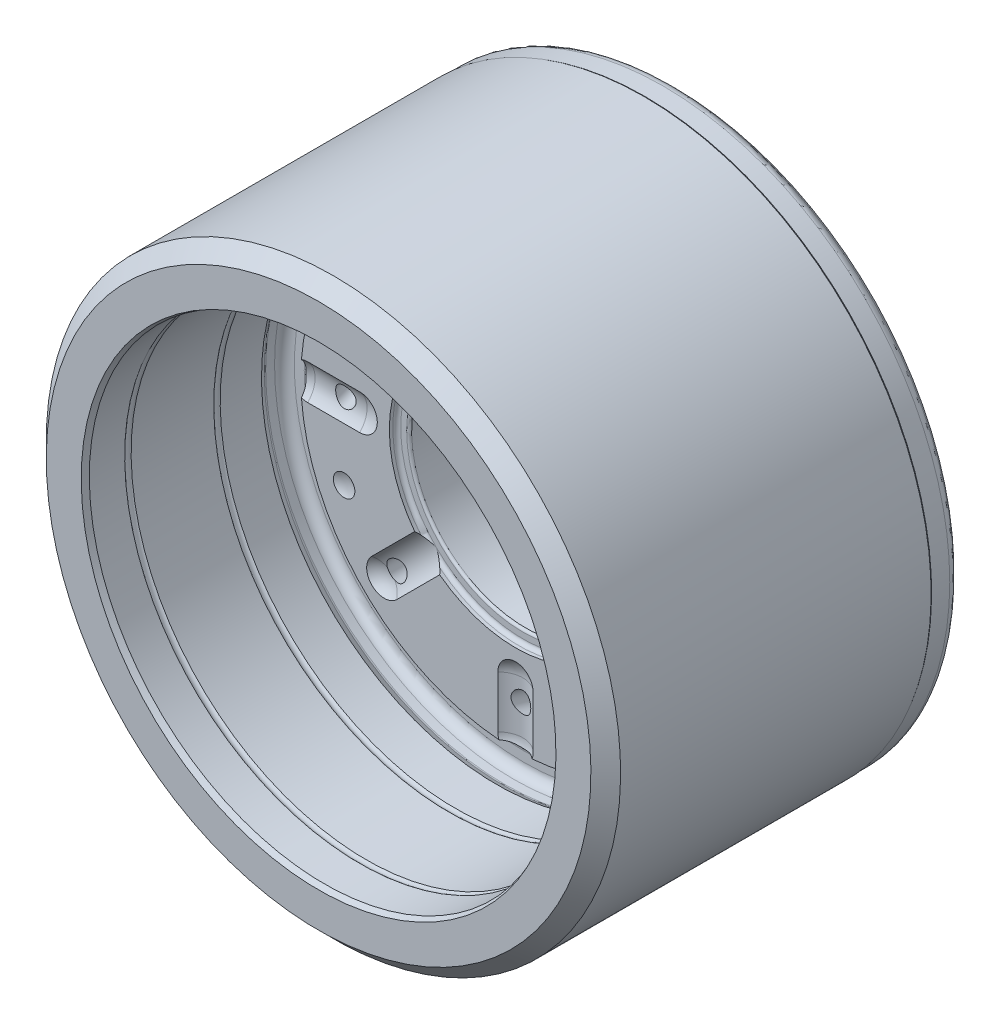
from build123d import *

# Parameters (mm, degrees)
FILLET1_R          = 2
CIRPATTERN1_COUNT  = 4
CIRPATTERN3_COUNT  = 4
CIRPATTERN2_COUNT  = 8
CIRPATTERN4_COUNT  = 4
CUT_EXTRUDE1_DEPTH = 0.1


with BuildPart() as part:
    # Sketch1 → Revolve1 (revolve)
    with BuildSketch(Plane(origin=(0, 0, 0), x_dir=(0, 0, -1), z_dir=(1, 0, 0))):
        with BuildLine():
            Line((0, 47.976764281), (1.2, 47.54))
            Line((1.2, 47.54), (8.35, 47.54))
            ThreePointArc((8.35, 47.54), (9, 47.780065792), (9.65, 47.54))
            Line((9.65, 47.54), (26.35, 47.54))
            ThreePointArc((26.35, 47.54), (27, 47.780065792), (27.65, 47.54))
            Line((27.65, 47.54), (36, 47.54))
            Line((36, 47.54), (37.303923048, 48.292820323))
            ThreePointArc((37.303923048, 48.292820323), (37.496867812, 48.372740661), (37.703923048, 48.4))
            Line((37.703923048, 48.4), (39.5, 48.4))
            ThreePointArc((39.5, 48.4), (40.914213562, 47.814213562), (41.5, 46.4))
            Line((41.5, 46.4), (41.5, 44.4))
            ThreePointArc((41.5, 44.4), (41.207106781, 43.692893219), (40.5, 43.4))
            Line((40.5, 43.4), (39.8, 43.4))
            Line((39.8, 43.4), (39.8, 25.5))
            Line((39.8, 25.5), (40.5, 25.5))
            ThreePointArc((40.5, 25.5), (41.065685425, 25.265685425), (41.3, 24.7))
            Line((41.3, 24.7), (41.3, 23.5))
            ThreePointArc((41.3, 23.5), (41.446446609, 23.146446609), (41.8, 23))
            Line((41.8, 23), (68, 23))
            ThreePointArc((68, 23), (68.353553391, 23.146446609), (68.5, 23.5))
            Line((68.5, 23.5), (68.5, 25.7))
            ThreePointArc((68.5, 25.7), (68.734314575, 26.265685425), (69.3, 26.5))
            Line((69.3, 26.5), (71.5, 26.5))
            ThreePointArc((71.5, 26.5), (71.853553391, 26.646446609), (72, 27))
            Line((72, 27), (72, 37.5))
            ThreePointArc((72, 37.5), (71.853553391, 37.853553391), (71.5, 38))
            Line((71.5, 38), (69, 38))
            ThreePointArc((69, 38), (67.585786438, 38.585786438), (67, 40))
            Line((67, 40), (67, 43.779733752))
            ThreePointArc((67, 43.779733752), (67.361695911, 44.926886625), (68.315959713, 45.659118994))
            Line((68.315959713, 45.659118994), (71.671010072, 46.880257459))
            ThreePointArc((71.671010072, 46.880257459), (71.909576022, 47.063315551), (72, 47.350103769))
            Line((72, 47.350103769), (72, 56.4))
            Line((72, 56.4), (70.5, 57.9))
            Line((70.5, 57.9), (66, 57.9))
            Line((66, 57.9), (65.757512887, 58.04))
            Line((65.757512887, 58.04), (3, 58.04))
            Line((3, 58.04), (0, 55.04))
            Line((0, 55.04), (0, 47.976764281))
        make_face()
    revolve(axis=Axis((0, 0, -19.396975733), (0, 0, 1)))

    # Fillet1
    fillet1_edges = [part.edges().sort_by_distance(p)[0] for p in [
        (0, -57.9, -70.5),
    ]]
    fillet(fillet1_edges, radius=FILLET1_R)

    # Sketch2 → Cut-Revolve1 (revolve, cut)
    with BuildSketch(Plane(origin=(0, 0, 0), x_dir=(0, 0, -1), z_dir=(1, 0, 0))):
        with BuildLine():
            Line((41.3, 42), (41.3, 31.5))
            ThreePointArc((41.3, 31.5), (39.835533906, 27.964466094), (36.3, 26.5))
            Line((36.3, 26.5), (36.3, 47))
            ThreePointArc((36.3, 47), (39.835533906, 45.535533906), (41.3, 42))
        make_face()
    cut_revolve1 = revolve(axis=Axis((0, 26.5, -36.3), (0, 1, 0)), mode=Mode.SUBTRACT)

    # CirPattern1: Cut-Revolve1 ×4 about axis
    cirpattern1_axis = Axis((0, 0, -19.396975733), (0, 0, -1))
    for i in range(1, CIRPATTERN1_COUNT):
        add(cut_revolve1.rotate(cirpattern1_axis, i * 360 / CIRPATTERN1_COUNT), mode=Mode.SUBTRACT)

    # Sketch3 → Cut-Revolve2 (revolve, cut)
    with BuildSketch(Plane(origin=(0, 0, 0), x_dir=(0, 0, 1), z_dir=(0.7071067811865464, 0.7071067811865488, 0))):
        with BuildLine():
            Line((-41.3, 37.5), (-41.3, 8.791773424))
            Line((-41.3, 8.791773424), (-36.3, 8.791773424))
            Line((-36.3, 8.791773424), (-36.3, 42.5))
            ThreePointArc((-36.3, 42.5), (-39.835533906, 41.035533906), (-41.3, 37.5))
        make_face()
    cut_revolve2 = revolve(axis=Axis((0.553509258, -0.553509258, -36.3), (0.7071067811865487, -0.7071067811865465, 0)), mode=Mode.SUBTRACT)

    # CirPattern3: Cut-Revolve2 ×4 about axis
    cirpattern3_axis = Axis((0, 0, -19.396975733), (0, 0, -1))
    for i in range(1, CIRPATTERN3_COUNT):
        add(cut_revolve2.rotate(cirpattern3_axis, i * 360 / CIRPATTERN3_COUNT), mode=Mode.SUBTRACT)

    # Sketch4 → 4MM HOLE Cut-Revolve3 (revolve, cut)
    with BuildSketch(Plane(origin=(0, 0, 0), x_dir=(0, 0, -1), z_dir=(1, 0, 0))):
        Polygon((71.48236191, 45.931851653), (34.777180511, 36.096727939), (34.134045021, 33.853847943), (72, 44), align=None)
    f_4mm_hole_cut_revolve3 = revolve(axis=Axis((0, 44, -72), (0, -0.2588190451025216, 0.9659258262890681)), mode=Mode.SUBTRACT)

    # CirPattern2: 4MM HOLE Cut-Revolve3 ×8 about axis
    cirpattern2_axis = Axis((0, 0, -19.396975733), (0, 0, -1))
    for i in range(1, CIRPATTERN2_COUNT):
        add(f_4mm_hole_cut_revolve3.rotate(cirpattern2_axis, i * 360 / CIRPATTERN2_COUNT), mode=Mode.SUBTRACT)

    # Sketch10 → WEAR INDICATOR Cut-Revolve3 (revolve, cut)
    with BuildSketch(Plane(origin=(0, 0, 0), x_dir=(0, 0, 1), z_dir=(-0.9238795325112865, -0.38268343236509056, 0))):
        with BuildLine():
            Line((-40.3, 37.5), (-18.472269002, 37.5))
            Line((-18.472269002, 37.5), (-18.472269002, 42.5))
            Line((-18.472269002, 42.5), (-35.3, 42.5))
            ThreePointArc((-35.3, 42.5), (-38.835533906, 41.035533906), (-40.3, 37.5))
        make_face()
    wear_indicator_cut_revolve3 = revolve(axis=Axis((-14.350628714, 34.645482469, -39.8), (0, 0, -1)), mode=Mode.SUBTRACT)

    # CirPattern4: WEAR INDICATOR Cut-Revolve3 ×4 about axis
    cirpattern4_axis = Axis((0, 0, -19.396975733), (0, 0, -1))
    for i in range(1, CIRPATTERN4_COUNT):
        add(wear_indicator_cut_revolve3.rotate(cirpattern4_axis, i * 360 / CIRPATTERN4_COUNT), mode=Mode.SUBTRACT)

    # Sketch8 → Cut-Extrude1 (cut)
    # profile 1 of 21: a face of its own
    with BuildSketch(Plane(origin=(0, 0, -72), x_dir=(-1, 0, 0), z_dir=(0, 0, -1))):
        Polygon((23.854300167, 19.760375543), (24.069444398, 19.48573612), (23.594684783, 18.205688043), (24.954660744, 18.35713035), (25.167401129, 18.085495735), (23.481103052, 17.89198612), (22.856103052, 16.197875543), (22.640958821, 16.472514966), (23.147569398, 17.854726504), (21.681824206, 17.695471697), (21.466079014, 17.97011112), (23.263554975, 18.16963035), align=None)
    # profile 2 of 21: a face of its own
    with BuildSketch(Plane(origin=(0, 0, -72), x_dir=(-1, 0, 0), z_dir=(0, 0, -1))):
        Polygon((21.978176565, 21.82611048), (22.216157334, 21.570701826), (21.851373681, 20.253995096), (23.193921758, 20.522023942), (23.429498681, 20.269620096), (21.765436181, 19.932480672), (21.287070796, 18.191495096), (21.049090027, 18.446903749), (21.436109258, 19.866975865), (19.989594834, 19.583322019), (19.751013104, 19.838730672), (21.524450604, 20.190894134), align=None)
    # profile 3 of 21: a face of its own
    with BuildSketch(Plane(origin=(0, 0, -72), x_dir=(-1, 0, 0), z_dir=(0, 0, -1))):
        Polygon((19.59696173, 21.709669369), (20.413067499, 20.943443407), (20.243596345, 20.762553984), (19.427490576, 21.528779946), align=None)
    # profile 4 of 21: a face of its own
    with BuildSketch(Plane(origin=(0, 0, -72), x_dir=(-1, 0, 0), z_dir=(0, 0, -1))):
        Polygon((19.337952914, 24.159704368), (19.788674068, 23.788911099), (17.905260607, 21.49624283), (17.677496183, 21.68374283), (19.376414453, 23.752252445), (19.016438491, 24.047925522), align=None)
    # profile 5 of 21: a face of its own
    with BuildSketch(Plane(origin=(0, 0, -72), x_dir=(-1, 0, 0), z_dir=(0, 0, -1))):
        Polygon((17.337174867, 25.6463853), (17.81493929, 25.303236262), (16.068545059, 22.872346839), (15.827559482, 23.045423762), (17.403280636, 25.238332416), (17.021069097, 25.512971839), align=None)
    # profile 6 of 21: a face of its own
    with BuildSketch(Plane(origin=(0, 0, -72), x_dir=(-1, 0, 0), z_dir=(0, 0, -1))):
        Polygon((15.128989206, 27.028431216), (15.639205552, 26.735161985), (14.146417091, 24.138407177), (13.888604591, 24.286844677), (15.235359398, 26.629392754), (14.827907475, 26.863166793), align=None)
    # profile 7 of 21: a face of its own
    with BuildSketch(Plane(origin=(0, 0, -72), x_dir=(-1, 0, 0), z_dir=(0, 0, -1))):
        Polygon((12.849647008, 28.179563056), (13.381497969, 27.929563056), (12.108060469, 25.222231326), (11.839430662, 25.348433249), (12.988469123, 27.790740941), (12.562988354, 27.990861133), align=None)
    # profile 8 of 21: a face of its own
    with BuildSketch(Plane(origin=(0, 0, -72), x_dir=(-1, 0, 0), z_dir=(0, 0, -1))):
        Polygon((10.480333402, 29.129734849), (11.028410325, 28.924806964), (9.985141094, 26.134542541), (9.708698786, 26.237907925), (10.649804555, 28.754734849), (10.211102632, 28.918797349), align=None)
    # profile 9 of 21: a face of its own
    with BuildSketch(Plane(origin=(0, 0, -72), x_dir=(-1, 0, 0), z_dir=(0, 0, -1))):
        Polygon((3.000616351, 30.829381525), (4.146650005, 27.730823833), (3.826337505, 27.75726614), (3.438116351, 28.777698833), (2.152058659, 28.883468063), (1.605183659, 27.939958448), (1.272250966, 27.967001717), (2.927299043, 30.83539114), align=None)
        Polygon((2.912275005, 30.199573833), (2.310111543, 29.160511333), (3.330544236, 29.076376717), align=None, mode=Mode.SUBTRACT)
    # profile 10 of 21: a face of its own
    with BuildSketch(Plane(origin=(0, 0, -72), x_dir=(-1, 0, 0), z_dir=(0, 0, -1))):
        Polygon((-1.261860941, 29.214776951), (-0.145875365, 29.23761349), (-0.141067672, 28.990618297), (-1.257053249, 28.967781759), align=None)
    # profile 11 of 21: a face of its own
    with BuildSketch(Plane(origin=(0, 0, -72), x_dir=(-1, 0, 0), z_dir=(0, 0, -1))):
        Polygon((-4.413552643, 30.635439153), (-3.832422836, 30.707554537), (-3.464033413, 27.75142473), (-3.757903605, 27.714766076), (-4.090235336, 30.381232422), (-4.554177643, 30.323540114), align=None)
    # profile 12 of 21: a face of its own
    with BuildSketch(Plane(origin=(0, 0, -72), x_dir=(-1, 0, 0), z_dir=(0, 0, -1))):
        Polygon((-7.378386469, 30.085449511), (-5.520814353, 30.473670665), (-6.459516276, 27.14374278), (-6.7263432, 27.217060088), (-5.916848007, 30.101675472), (-7.3200932, 29.808406242), align=None)
    # profile 13 of 21: a face of its own
    with BuildSketch(Plane(origin=(0, 0, -72), x_dir=(-1, 0, 0), z_dir=(0, 0, -1))):
        Polygon((-10.608094085, 29.090068096), (-10.054608508, 29.284178673), (-9.067829662, 26.466270019), (-9.347276777, 26.368313288), (-10.237300816, 28.910380596), (-10.679608508, 28.755332519), align=None)
    # profile 14 of 21: a face of its own
    with BuildSketch(Plane(origin=(0, 0, -72), x_dir=(-1, 0, 0), z_dir=(0, 0, -1))):
        Polygon((-12.96834317, 28.125658666), (-12.431083554, 28.364841358), (-11.213535478, 25.629865397), (-11.485170093, 25.509072127), (-12.583126824, 27.976019243), (-13.012814324, 27.784913474), align=None)
    # profile 15 of 21: a face of its own
    with BuildSketch(Plane(origin=(0, 0, -72), x_dir=(-1, 0, 0), z_dir=(0, 0, -1))):
        with BuildLine():
            Line((-13.738896429, 24.287135812), (-14.030963737, 24.307568505))
            Line((-14.030963737, 24.307568505), (-13.913776237, 25.770909851))
            add(Edge.make_bspline(
                [(-13.913776237, 25.770909851), (-13.93312239, 25.750980634), (-13.970773973, 25.712194291), (-14.030861273, 25.660174862), (-14.091743855, 25.614769307), (-14.134494441, 25.589658071), (-14.155362775, 25.577400235)],
                knots=[0, 0, 0, 0, 1.072129487, 2.086583847, 3.065982227, 4, 4, 4, 4], degree=3))
            add(Edge.make_bspline(
                [(-14.155362775, 25.577400235), (-14.181366961, 25.564055474), (-14.232546787, 25.537791143), (-14.312573695, 25.507864899), (-14.393132776, 25.485581362), (-14.475110138, 25.474102464), (-14.55781575, 25.469372301), (-14.641579279, 25.474619018), (-14.726191673, 25.487703831), (-14.810354131, 25.510216728), (-14.89269322, 25.539579428), (-14.970624749, 25.577519114), (-15.044298008, 25.620844074), (-15.112069921, 25.672897219), (-15.175270178, 25.731028265), (-15.233247559, 25.796593477), (-15.286413488, 25.868798979), (-15.317076966, 25.921057925), (-15.332646429, 25.947592543)],
                knots=[0, 0, 0, 0, 1.019339521, 2.006200876, 2.976276971, 3.93042557, 4.889505071, 5.862926222, 6.853742157, 7.872913828, 8.899111551, 9.899769985, 10.893762844, 11.87677803, 12.876190055, 13.886449974, 14.92683936, 16, 16, 16, 16], degree=3))
            add(Edge.make_bspline(
                [(-15.332646429, 25.947592543), (-15.351736849, 25.985200745), (-15.389262466, 26.05912636), (-15.426595354, 26.176324465), (-15.449880345, 26.294523567), (-15.454632806, 26.413898204), (-15.445019244, 26.532886602), (-15.417302689, 26.649154716), (-15.37482835, 26.762714384), (-15.316069796, 26.871029307), (-15.243768912, 26.97219502), (-15.159497589, 27.062914906), (-15.06490175, 27.143031089), (-14.993957331, 27.185320534), (-14.958247391, 27.206606966)],
                knots=[0, 0, 0, 0, 1.035927997, 2.036300839, 3.014288727, 3.990922671, 4.965229411, 5.941726614, 6.920979799, 7.939511894, 8.963677912, 9.971341679, 10.978872915, 12, 12, 12, 12], degree=3))
            add(Edge.make_bspline(
                [(-14.958247391, 27.206606966), (-14.921824164, 27.225045997), (-14.850030448, 27.261391117), (-14.735384096, 27.29801872), (-14.617993178, 27.319368277), (-14.498388385, 27.324311989), (-14.379266228, 27.315398065), (-14.262943239, 27.289061016), (-14.1511557, 27.246667709), (-14.045009027, 27.188700635), (-13.946701435, 27.11827096), (-13.857624489, 27.037336461), (-13.781301435, 26.944613441), (-13.739891873, 26.876221453), (-13.719064698, 26.841823312)],
                knots=[0, 0, 0, 0, 1.021108704, 2.012704402, 3.001707623, 4.001103368, 5.002700386, 5.984923454, 6.977280357, 7.987485027, 9.005186405, 9.999405796, 10.993789729, 12, 12, 12, 12], degree=3))
            add(Edge.make_bspline(
                [(-13.719064698, 26.841823312), (-13.704920051, 26.814018733), (-13.676107332, 26.75738066), (-13.641993394, 26.666178452), (-13.616045938, 26.568429975), (-13.599369774, 26.482649573), (-13.58997291, 26.409652539), (-13.584467711, 26.350331013), (-13.58173016, 26.286962631), (-13.580511748, 26.219631984), (-13.58123227, 26.148097249), (-13.583472333, 26.072538343), (-13.588501725, 25.993009593), (-13.592972205, 25.938771094), (-13.595266621, 25.910933889)],
                knots=[0, 0, 0, 0, 1.177522787, 2.398620042, 3.66865854, 4.993684901, 5.695620907, 6.447709179, 7.243002857, 8.09049103, 8.990835468, 9.944587925, 10.945086475, 12, 12, 12, 12], degree=3))
            Line((-13.595266621, 25.910933889), (-13.738896429, 24.287135812))
        make_face()
        with BuildLine():
            add(Edge.make_bspline(
                [(-14.221468544, 25.841222351), (-14.202799128, 25.852069887), (-14.16617153, 25.873351709), (-14.116093227, 25.911156314), (-14.070361198, 25.952330637), (-14.029762646, 25.997596724), (-13.994486467, 26.0471986), (-13.963857286, 26.100085221), (-13.937682683, 26.156891359), (-13.917698694, 26.217265332), (-13.902854096, 26.278980005), (-13.893303523, 26.340912964), (-13.891465026, 26.402121413), (-13.893685249, 26.462842245), (-13.904742521, 26.522454489), (-13.919891766, 26.581655019), (-13.942596799, 26.639887092), (-13.961722929, 26.677317936), (-13.971468544, 26.69639062)],
                knots=[0, 0, 0, 0, 1.044606474, 2.049417247, 3.031310928, 4.020411352, 4.98666017, 5.973141717, 6.975703122, 8.009310334, 9.04673295, 10.046663694, 11.03671472, 12.007819091, 12.982066594, 13.965444113, 14.963303046, 16, 16, 16, 16], degree=3))
            add(Edge.make_bspline(
                [(-13.971468544, 26.69639062), (-13.982127124, 26.714846298), (-14.003170678, 26.751283896), (-14.040578706, 26.801357577), (-14.082601868, 26.845904502), (-14.127413447, 26.886519455), (-14.176879689, 26.921510159), (-14.229573564, 26.952338769), (-14.286697856, 26.977625854), (-14.346713557, 26.997687503), (-14.408401422, 27.012766335), (-14.470161239, 27.021988625), (-14.531600713, 27.024292901), (-14.592180765, 27.020708421), (-14.652291654, 27.011212127), (-14.71148804, 26.994445741), (-14.770467628, 26.972633129), (-14.808187513, 26.953200285), (-14.827237775, 26.943385812)],
                knots=[0, 0, 0, 0, 1.032047237, 2.03760182, 3.019646928, 3.995774453, 4.962738536, 5.949950324, 6.949255225, 7.983627563, 9.012383358, 10.022658113, 11.003743442, 11.98578855, 12.959161583, 13.945800631, 14.962535633, 16, 16, 16, 16], degree=3))
            add(Edge.make_bspline(
                [(-14.827237775, 26.943385812), (-14.845706723, 26.932740683), (-14.88217052, 26.911723685), (-14.932170696, 26.874033244), (-14.977419419, 26.832699056), (-15.017238745, 26.78700832), (-15.053050285, 26.738203806), (-15.083953108, 26.685133585), (-15.108772631, 26.627574864), (-15.129936363, 26.567677129), (-15.144759203, 26.505832791), (-15.154051641, 26.44409607), (-15.156332733, 26.382855541), (-15.152784025, 26.322457887), (-15.143031906, 26.262683296), (-15.127536969, 26.20356482), (-15.104927494, 26.145319215), (-15.085788184, 26.107890237), (-15.076035852, 26.088818505)],
                knots=[0, 0, 0, 0, 1.032821103, 2.039129686, 3.029037543, 3.999452854, 4.972829049, 5.960781083, 6.969711485, 8.007999216, 9.037526408, 10.048558702, 11.030379685, 12.003465044, 12.977567947, 13.962411326, 14.961757705, 16, 16, 16, 16], degree=3))
            add(Edge.make_bspline(
                [(-15.076035852, 26.088818505), (-15.065390948, 26.07034913), (-15.044374393, 26.033884491), (-15.006680706, 25.983890474), (-14.965358517, 25.938618992), (-14.919623893, 25.898882908), (-14.871064037, 25.862819026), (-14.817552617, 25.833186754), (-14.761006539, 25.806754564), (-14.700574707, 25.786950587), (-14.638943064, 25.771704307), (-14.576871988, 25.763550787), (-14.515740801, 25.760123625), (-14.4550352, 25.763728798), (-14.395402661, 25.774417319), (-14.336204692, 25.789667045), (-14.277971928, 25.812344959), (-14.24054118, 25.831474829), (-14.221468544, 25.841222351)],
                knots=[0, 0, 0, 0, 1.032992473, 2.039468027, 3.029540134, 4.00011646, 4.973654162, 5.956934718, 6.961157176, 7.996476879, 9.035618306, 10.035838455, 11.027957988, 12.001204806, 12.977066452, 13.96207324, 14.961585436, 16, 16, 16, 16], degree=3))
        make_face(mode=Mode.SUBTRACT)
    # profile 16 of 21: a face of its own
    with BuildSketch(Plane(origin=(0, 0, -72), x_dir=(-1, 0, 0), z_dir=(0, 0, -1))):
        Polygon((-18.821462091, 24.576299722), (-17.29742363, 25.679064145), (-16.799226514, 22.284833376), (-17.070260168, 22.24336703), (-17.505356322, 25.182068953), (-18.65679863, 24.349136261), align=None)
    # profile 17 of 21: a face of its own
    with BuildSketch(Plane(origin=(0, 0, -72), x_dir=(-1, 0, 0), z_dir=(0, 0, -1))):
        with BuildLine():
            add(Edge.make_bspline(
                [(-19.944812924, 21.714765492), (-19.975745441, 21.751192479), (-20.035782828, 21.821894166), (-20.118618648, 21.928758828), (-20.193968841, 22.031286282), (-20.260848803, 22.130145332), (-20.318438845, 22.225512189), (-20.369249743, 22.316120557), (-20.409754748, 22.404035566), (-20.443530472, 22.488158274), (-20.469297829, 22.569836146), (-20.489558786, 22.649450693), (-20.502970045, 22.72768144), (-20.512512316, 22.804058439), (-20.515544823, 22.879034025), (-20.512446725, 22.952361094), (-20.504092655, 23.02409725), (-20.490244563, 23.09403437), (-20.471085398, 23.161741396), (-20.44690635, 23.226729603), (-20.41857927, 23.289095623), (-20.385543159, 23.34866197), (-20.347535863, 23.405340608), (-20.304704799, 23.458987856), (-20.257047749, 23.509608096), (-20.222474899, 23.540914994), (-20.20502927, 23.556712608)],
                knots=[0, 0, 0, 0, 1.644029868, 3.190922287, 4.650811431, 6.021416974, 7.295645233, 8.483234603, 9.593293926, 10.623587759, 11.600101059, 12.537878117, 13.447786021, 14.329186333, 15.18452019, 16.026080918, 16.851915477, 17.666980841, 18.476431854, 19.27020876, 20.050526242, 20.831087192, 21.611008875, 22.395697237, 23.190460963, 24, 24, 24, 24], degree=3))
            add(Edge.make_bspline(
                [(-20.20502927, 23.556712608), (-20.186648297, 23.57205879), (-20.150217052, 23.602475053), (-20.091574486, 23.642132119), (-20.03070968, 23.67634943), (-19.968045871, 23.705874466), (-19.903500513, 23.730825447), (-19.836710533, 23.749994008), (-19.767736323, 23.763732811), (-19.696863922, 23.772816575), (-19.624325317, 23.776493622), (-19.550565285, 23.773999378), (-19.475827516, 23.765496563), (-19.399922071, 23.750932135), (-19.323001672, 23.730474854), (-19.245179454, 23.703765715), (-19.166349237, 23.671168611), (-19.086249164, 23.632543585), (-19.004548524, 23.587482843), (-18.922142462, 23.533422589), (-18.837997113, 23.471541539), (-18.752855125, 23.400966749), (-18.666102312, 23.322507553), (-18.577811944, 23.235976725), (-18.488360683, 23.14082972), (-18.429392075, 23.073715721), (-18.399139847, 23.039284723)],
                knots=[0, 0, 0, 0, 0.817209956, 1.619717106, 2.412988777, 3.19935934, 3.983137515, 4.773306705, 5.568787025, 6.382410885, 7.21107675, 8.046014192, 8.89957212, 9.776916611, 10.682806885, 11.615091664, 12.584284537, 13.593861856, 14.650204943, 15.767672928, 16.956528171, 18.215046031, 19.542020395, 20.949564044, 22.435057429, 24, 24, 24, 24], degree=3))
            add(Edge.make_bspline(
                [(-18.399139847, 23.039284723), (-18.369881681, 23.004402931), (-18.312734242, 22.936271351), (-18.232829714, 22.833878282), (-18.161351128, 22.73371187), (-18.096497998, 22.63725715), (-18.040520281, 22.542649891), (-17.992374437, 22.450778809), (-17.951638229, 22.361636292), (-17.919230175, 22.274726904), (-17.893126222, 22.190239467), (-17.873358657, 22.107686837), (-17.858636166, 22.02708039), (-17.85008959, 21.948139351), (-17.847841294, 21.870809656), (-17.850490285, 21.79523883), (-17.859770741, 21.721537424), (-17.874006115, 21.649954338), (-17.894096322, 21.580757688), (-17.918369023, 21.514071109), (-17.948409199, 21.450722126), (-17.981699171, 21.389548109), (-18.021139276, 21.33207642), (-18.064472542, 21.277055476), (-18.112598795, 21.225055863), (-18.148070352, 21.19345129), (-18.16596677, 21.177505877)],
                knots=[0, 0, 0, 0, 1.556205287, 3.039600934, 4.438183977, 5.761895265, 7.011408319, 8.193647714, 9.306086448, 10.35917686, 11.362025172, 12.326963321, 13.259128486, 14.16125834, 15.038165563, 15.90162898, 16.743313973, 17.574572791, 18.39381483, 19.204079234, 19.997502707, 20.788292034, 21.582158603, 22.376733614, 23.181015553, 24, 24, 24, 24], degree=3))
            add(Edge.make_bspline(
                [(-18.16596677, 21.177505877), (-18.184194687, 21.162622593), (-18.220288121, 21.133151926), (-18.277565439, 21.0938193), (-18.337178709, 21.060474705), (-18.398412342, 21.031042104), (-18.46177966, 21.007217849), (-18.527325481, 20.988493383), (-18.5945946, 20.974565613), (-18.663940219, 20.966265335), (-18.734678526, 20.963084148), (-18.806399643, 20.966381241), (-18.878959596, 20.974687717), (-18.952456266, 20.98933319), (-19.026998474, 21.009726212), (-19.102260063, 21.036620443), (-19.178689028, 21.068301969), (-19.256174078, 21.106614498), (-19.335461227, 21.151729558), (-19.416088515, 21.206371182), (-19.498827994, 21.269739008), (-19.58434757, 21.341201696), (-19.671237512, 21.42218058), (-19.760954471, 21.511245429), (-19.852957886, 21.609268276), (-19.913589965, 21.678905345), (-19.944812924, 21.714765492)],
                knots=[0, 0, 0, 0, 0.810632812, 1.605149, 2.390224817, 3.162081483, 3.944086726, 4.71963798, 5.508829557, 6.308456187, 7.123660273, 7.945760539, 8.779656246, 9.637878073, 10.525355896, 11.440036421, 12.389901381, 13.37461292, 14.416519684, 15.53068256, 16.727572739, 18.006365248, 19.369131277, 20.818699714, 22.361764809, 24, 24, 24, 24], degree=3))
        make_face()
        with BuildLine():
            add(Edge.make_bspline(
                [(-19.727264847, 21.893852031), (-19.7006236, 21.863022591), (-19.648956755, 21.803233353), (-19.570546251, 21.719283202), (-19.495724899, 21.642214079), (-19.423631508, 21.572980187), (-19.354535844, 21.511557678), (-19.28845333, 21.457598122), (-19.224607967, 21.411996222), (-19.163651431, 21.372812426), (-19.103767805, 21.340996765), (-19.045628723, 21.312665624), (-18.987051114, 21.290816816), (-18.929573731, 21.272566764), (-18.872546565, 21.25904422), (-18.815832843, 21.250884502), (-18.75958775, 21.246166227), (-18.686471479, 21.248374648), (-18.598968473, 21.258981929), (-18.5008633, 21.287891639), (-18.410614856, 21.329207205), (-18.359211435, 21.369163566), (-18.333635039, 21.389044338)],
                knots=[0, 0, 0, 0, 1.475909868, 2.862313715, 4.160626624, 5.366757585, 6.482248386, 7.509049202, 8.455550054, 9.323242429, 10.131745549, 10.910792781, 11.664169876, 12.394043606, 13.094613191, 13.784273586, 14.468298686, 15.136079208, 16.431326151, 17.648431549, 18.829948603, 20, 20, 20, 20], degree=3))
            add(Edge.make_bspline(
                [(-18.333635039, 21.389044338), (-18.30969484, 21.41167849), (-18.262155325, 21.456624505), (-18.206426105, 21.538962569), (-18.163639022, 21.630429189), (-18.1391693, 21.713681743), (-18.127350579, 21.784197533), (-18.12243954, 21.839459132), (-18.122545044, 21.896154927), (-18.127359248, 21.954044199), (-18.137355155, 22.013190886), (-18.150982024, 22.073907518), (-18.169883938, 22.136010695), (-18.185184551, 22.177380813), (-18.193010039, 22.198539531)],
                knots=[0, 0, 0, 0, 1.345943048, 2.672721216, 4.041671809, 5.469536967, 6.210010879, 6.967647844, 7.738844989, 8.529180594, 9.343839889, 10.193680383, 11.076159098, 12, 12, 12, 12], degree=3))
            add(Edge.make_bspline(
                [(-18.193010039, 22.198539531), (-18.203704131, 22.224924755), (-18.225540647, 22.278801357), (-18.265038354, 22.358282205), (-18.309092658, 22.438974198), (-18.357581367, 22.520970659), (-18.412475377, 22.60316755), (-18.472904911, 22.685977715), (-18.537497559, 22.770391397), (-18.584005734, 22.825528583), (-18.6076735, 22.853587608)],
                knots=[0, 0, 0, 0, 0.877069443, 1.790908413, 2.732899876, 3.710077205, 4.72537275, 5.777424396, 6.868942936, 8, 8, 8, 8], degree=3))
            add(Edge.make_bspline(
                [(-18.6076735, 22.853587608), (-18.631780883, 22.881147864), (-18.678938848, 22.935060211), (-18.750318678, 23.012175401), (-18.821251649, 23.082956487), (-18.890924945, 23.148231174), (-18.960053464, 23.206999236), (-19.027960552, 23.260319573), (-19.095454702, 23.307017076), (-19.161342312, 23.348855255), (-19.226661204, 23.384197142), (-19.290078178, 23.415085471), (-19.352391609, 23.440302651), (-19.413134649, 23.461431803), (-19.47326051, 23.475361302), (-19.531625248, 23.485449702), (-19.588774221, 23.489564597), (-19.661711903, 23.488835677), (-19.748822816, 23.47706871), (-19.846547428, 23.449846539), (-19.935949427, 23.407595442), (-19.987119034, 23.367993603), (-20.012721577, 23.348178954)],
                knots=[0, 0, 0, 0, 1.326113798, 2.594094433, 3.804802849, 4.954682461, 6.050872875, 7.0899724, 8.080178667, 9.022250937, 9.915098248, 10.768519643, 11.575531773, 12.34870066, 13.094811375, 13.808064175, 14.491930584, 15.166692574, 16.447251193, 17.662061106, 18.83022005, 20, 20, 20, 20], degree=3))
            add(Edge.make_bspline(
                [(-20.012721577, 23.348178954), (-20.036723667, 23.325791312), (-20.084610161, 23.281125798), (-20.139736331, 23.198028148), (-20.183759453, 23.106040828), (-20.20769186, 23.021488043), (-20.21960884, 22.95002359), (-20.224541649, 22.894354012), (-20.224251341, 22.837286144), (-20.220197859, 22.779010783), (-20.211077025, 22.719339844), (-20.196908389, 22.658435698), (-20.179015881, 22.596190983), (-20.156422244, 22.532073644), (-20.128140877, 22.465313112), (-20.091330436, 22.395834486), (-20.048802978, 22.321501328), (-19.99805183, 22.243893181), (-19.940803764, 22.161871131), (-19.876312467, 22.076009968), (-19.804806499, 21.985804065), (-19.753671881, 21.925166562), (-19.727264847, 21.893852031)],
                knots=[0, 0, 0, 0, 1.184686907, 2.363565127, 3.583407342, 4.866569796, 5.528320876, 6.20531733, 6.887075563, 7.592421537, 8.318638498, 9.069919485, 9.854960268, 10.662396592, 11.529971892, 12.477170674, 13.507213986, 14.629774313, 15.8329655, 17.128306954, 18.51699498, 20, 20, 20, 20], degree=3))
        make_face(mode=Mode.SUBTRACT)
    # profile 18 of 21: a face of its own
    with BuildSketch(Plane(origin=(0, 0, -72), x_dir=(-1, 0, 0), z_dir=(0, 0, -1))):
        with BuildLine():
            add(Edge.make_bspline(
                [(-21.667201007, 20.004685686), (-21.701044852, 20.03875461), (-21.766657373, 20.104803486), (-21.859087553, 20.204041209), (-21.941777255, 20.300886648), (-22.016678346, 20.394031046), (-22.082994185, 20.4840293), (-22.140383175, 20.571180369), (-22.188656002, 20.655531444), (-22.228785581, 20.736968433), (-22.260807592, 20.816757444), (-22.287087135, 20.894653047), (-22.308856739, 20.971276882), (-22.322909813, 21.047179518), (-22.332088002, 21.121841543), (-22.335890901, 21.195562543), (-22.333535779, 21.268139581), (-22.325040328, 21.339269629), (-22.311054959, 21.408507425), (-22.292649709, 21.475682158), (-22.269040377, 21.540362132), (-22.24067736, 21.602423743), (-22.207662432, 21.662341392), (-22.168805588, 21.719127799), (-22.126328775, 21.774563887), (-22.094009138, 21.80845347), (-22.077657738, 21.825599148)],
                knots=[0, 0, 0, 0, 1.646764792, 3.192556546, 4.649246638, 6.01283564, 7.290650449, 8.481486861, 9.589172542, 10.621461907, 11.592237614, 12.535047675, 13.44000826, 14.321136698, 15.179173836, 16.018274915, 16.849947549, 17.666242698, 18.471888925, 19.270209205, 20.052556987, 20.830306954, 21.608299588, 22.395188336, 23.188081333, 24, 24, 24, 24], degree=3))
            add(Edge.make_bspline(
                [(-22.077657738, 21.825599148), (-22.060496275, 21.842320443), (-22.026386595, 21.875555256), (-21.971066481, 21.91969972), (-21.913351102, 21.959143915), (-21.85350925, 21.994166078), (-21.790606053, 22.023478344), (-21.725494255, 22.048597561), (-21.657481433, 22.067202289), (-21.587591293, 22.082719032), (-21.515432752, 22.092268254), (-21.441456747, 22.095898954), (-21.365955897, 22.093126482), (-21.28891879, 22.08573715), (-21.210571224, 22.070648731), (-21.130414792, 22.050959115), (-21.048738202, 22.024994454), (-20.965460122, 21.992910392), (-20.880061243, 21.954388919), (-20.793164764, 21.907211431), (-20.703871673, 21.852270584), (-20.612807693, 21.789013338), (-20.519403128, 21.718027596), (-20.424685806, 21.638231544), (-20.326967918, 21.551175983), (-20.262719367, 21.488710683), (-20.229701007, 21.456608763)],
                knots=[0, 0, 0, 0, 0.815486936, 1.62084071, 2.406009902, 3.194549568, 3.978740393, 4.766719314, 5.567815529, 6.377232043, 7.203009531, 8.043004179, 8.896079875, 9.773673923, 10.67540353, 11.610120179, 12.583055922, 13.591404858, 14.647620836, 15.770704371, 16.955793192, 18.215928246, 19.544715579, 20.949070157, 22.432078242, 24, 24, 24, 24], degree=3))
            add(Edge.make_bspline(
                [(-20.229701007, 21.456608763), (-20.197428713, 21.424170394), (-20.134456587, 21.36087421), (-20.046101541, 21.264784663), (-19.966117194, 21.170544307), (-19.894487032, 21.07840575), (-19.830224374, 20.988705218), (-19.774384628, 20.900652897), (-19.726710547, 20.814512125), (-19.686717377, 20.730633234), (-19.653986287, 20.648247506), (-19.627775443, 20.56722481), (-19.606387472, 20.487692435), (-19.59104999, 20.409419479), (-19.582890698, 20.332392464), (-19.579849125, 20.256716737), (-19.581717627, 20.182287023), (-19.591392447, 20.109486745), (-19.604660366, 20.038619456), (-19.624398285, 19.97027326), (-19.648114688, 19.904238373), (-19.677304699, 19.840863368), (-19.710707676, 19.779821152), (-19.75049225, 19.722092999), (-19.793847575, 19.665922886), (-19.826740964, 19.631414584), (-19.843282738, 19.614060686)],
                knots=[0, 0, 0, 0, 1.559145224, 3.042321305, 4.446898076, 5.770023182, 7.018251311, 8.205660545, 9.320865266, 10.371238508, 11.370108417, 12.339359617, 13.271557446, 14.175226324, 15.054193335, 15.908153247, 16.755044875, 17.58734005, 18.407992582, 19.209688516, 20.00867714, 20.796773092, 21.585105514, 22.376505618, 23.183560057, 24, 24, 24, 24], degree=3))
            add(Edge.make_bspline(
                [(-19.843282738, 19.614060686), (-19.860226599, 19.597516126), (-19.893700762, 19.564830818), (-19.948514316, 19.521697909), (-20.004629776, 19.482490566), (-20.063647024, 19.448311929), (-20.125368567, 19.41984924), (-20.189381721, 19.395554863), (-20.255715318, 19.376361582), (-20.324179066, 19.361899169), (-20.394704497, 19.352714353), (-20.466672529, 19.350012773), (-20.54000993, 19.352273996), (-20.614752474, 19.360835655), (-20.690966633, 19.375503218), (-20.768750008, 19.395223063), (-20.847455244, 19.421438696), (-20.9281243, 19.452792922), (-21.011005197, 19.49126073), (-21.095793449, 19.539569343), (-21.184281261, 19.595361784), (-21.275376276, 19.660404524), (-21.369189848, 19.734290725), (-21.466670396, 19.815734714), (-21.566320739, 19.906971832), (-21.632905515, 19.971466655), (-21.667201007, 20.004685686)],
                knots=[0, 0, 0, 0, 0.812369368, 1.604910723, 2.390771683, 3.160952739, 3.942348544, 4.72141114, 5.509165128, 6.31025165, 7.121368642, 7.947245716, 8.779737668, 9.637821456, 10.52657376, 11.442186586, 12.390274386, 13.372244022, 14.412027956, 15.523403183, 16.719531051, 18.001706197, 19.363499815, 20.817972231, 22.361048614, 24, 24, 24, 24], degree=3))
        make_face()
        with BuildLine():
            add(Edge.make_bspline(
                [(-21.462874084, 20.201200109), (-21.433556151, 20.172620145), (-21.376727793, 20.117222229), (-21.292161032, 20.039042477), (-21.210863458, 19.968649848), (-21.133348027, 19.905194952), (-21.059145579, 19.849480629), (-20.988508135, 19.800924931), (-20.921466305, 19.759866104), (-20.856907912, 19.726337832), (-20.794553292, 19.699121778), (-20.733660272, 19.676921854), (-20.6740025, 19.658510812), (-20.614933515, 19.64526473), (-20.556666204, 19.636734472), (-20.499188462, 19.633275423), (-20.442708578, 19.633595525), (-20.369766952, 19.640921364), (-20.283212849, 19.659788133), (-20.187003136, 19.695634848), (-20.100850676, 19.745945913), (-20.052522752, 19.7898455), (-20.028378892, 19.811777033)],
                knots=[0, 0, 0, 0, 1.47829375, 2.865447736, 4.157569758, 5.360626452, 6.481727106, 7.506888085, 8.454592187, 9.318341863, 10.131328382, 10.909328365, 11.65754109, 12.384007343, 13.092869174, 13.781364463, 14.461296235, 15.12990019, 16.425156202, 17.647581756, 18.824769385, 20, 20, 20, 20], degree=3))
            add(Edge.make_bspline(
                [(-20.028378892, 19.811777033), (-20.006432652, 19.836325537), (-19.962776811, 19.885157848), (-19.913175423, 19.971365002), (-19.8774145, 20.066092658), (-19.860407811, 20.151269663), (-19.853831495, 20.222714923), (-19.853848652, 20.278241704), (-19.859072726, 20.334832144), (-19.867640105, 20.392444405), (-19.882633244, 20.451157408), (-19.901749389, 20.510733685), (-19.925289049, 20.571715599), (-19.944553699, 20.611586012), (-19.954460623, 20.632089533)],
                knots=[0, 0, 0, 0, 1.341321611, 2.668180233, 4.032147207, 5.459582494, 6.198507235, 6.959064043, 7.72242961, 8.517046348, 9.334235785, 10.192890011, 11.070686416, 12, 12, 12, 12], degree=3))
            add(Edge.make_bspline(
                [(-19.954460623, 20.632089533), (-19.967341421, 20.65771716), (-19.99354198, 20.709845773), (-20.039967418, 20.785847887), (-20.090347658, 20.863040453), (-20.146204952, 20.940522237), (-20.207855867, 21.017898168), (-20.273980763, 21.096429219), (-20.345961557, 21.17482316), (-20.39680202, 21.226201275), (-20.422609661, 21.25228184)],
                knots=[0, 0, 0, 0, 0.881578965, 1.793201104, 2.736223568, 3.71575336, 4.728700372, 5.777620052, 6.871875235, 8, 8, 8, 8], degree=3))
            add(Edge.make_bspline(
                [(-20.422609661, 21.25228184), (-20.449093731, 21.278090601), (-20.500767562, 21.328446816), (-20.579009694, 21.399309969), (-20.655307213, 21.464580354), (-20.730663825, 21.523492578), (-20.804385831, 21.577188546), (-20.877039243, 21.624655962), (-20.948137202, 21.666189118), (-21.017395464, 21.702583258), (-21.085255203, 21.733201468), (-21.151424499, 21.758664108), (-21.215937002, 21.778504884), (-21.278543996, 21.793643748), (-21.339347974, 21.80413863), (-21.398672949, 21.80906519), (-21.456205687, 21.808451166), (-21.529081519, 21.801146002), (-21.615057383, 21.783153772), (-21.709980923, 21.74656159), (-21.795983392, 21.697584856), (-21.844000601, 21.653868475), (-21.867922161, 21.632089533)],
                knots=[0, 0, 0, 0, 1.334861968, 2.604487568, 3.810075485, 4.958708226, 6.056617966, 7.101620199, 8.09012259, 9.02813527, 9.924672041, 10.776153994, 11.585893458, 12.35939853, 13.100058574, 13.811107515, 14.505373626, 15.173851761, 16.453202033, 17.661887455, 18.835182168, 20, 20, 20, 20], degree=3))
            add(Edge.make_bspline(
                [(-21.867922161, 21.632089533), (-21.889899115, 21.607563319), (-21.933847711, 21.558516818), (-21.983131132, 21.471502176), (-22.018146434, 21.375394751), (-22.035914127, 21.289444596), (-22.042519457, 21.217131232), (-22.042127645, 21.161068667), (-22.038440975, 21.104101185), (-22.028103599, 21.046388815), (-22.014424139, 20.987768122), (-21.996457467, 20.927754958), (-21.972672578, 20.867396674), (-21.944808623, 20.805215891), (-21.910958802, 20.740895004), (-21.868795359, 20.67404729), (-21.819725253, 20.603415634), (-21.762811208, 20.529526918), (-21.699254012, 20.451830261), (-21.627122842, 20.371369703), (-21.548243473, 20.286749436), (-21.49189285, 20.23028004), (-21.462874084, 20.201200109)],
                knots=[0, 0, 0, 0, 1.185624508, 2.370962504, 3.58084381, 4.865284346, 5.525637302, 6.197910666, 6.886503253, 7.582905787, 8.310571609, 9.058353835, 9.840997032, 10.649841687, 11.516447425, 12.461230957, 13.499959228, 14.619014847, 15.825955661, 17.121434853, 18.517631138, 20, 20, 20, 20], degree=3))
        make_face(mode=Mode.SUBTRACT)
    # profile 19 of 21: a face of its own
    with BuildSketch(Plane(origin=(0, 0, -72), x_dir=(-1, 0, 0), z_dir=(0, 0, -1))):
        with BuildLine():
            Line((-23.66947387, 19.162022996), (-23.629810408, 18.845917227))
            add(Edge.make_bspline(
                [(-23.629810408, 18.845917227), (-23.686335252, 18.835321725), (-23.797770325, 18.814433379), (-23.958959991, 18.765768134), (-24.111636817, 18.703738896), (-24.254850882, 18.628922864), (-24.386374758, 18.543158867), (-24.505999144, 18.449886), (-24.611425613, 18.347785548), (-24.671239411, 18.272467424), (-24.70072387, 18.235340303)],
                knots=[0, 0, 0, 0, 1.092348254, 2.153493946, 3.193454942, 4.220287921, 5.219238649, 6.173555523, 7.099677206, 8, 8, 8, 8], degree=3))
            add(Edge.make_bspline(
                [(-24.70072387, 18.235340303), (-24.717673741, 18.21151771), (-24.751298966, 18.16425835), (-24.795938501, 18.089668884), (-24.835403853, 18.012870409), (-24.870598725, 17.93371457), (-24.900568011, 17.852226068), (-24.92520799, 17.768253646), (-24.945049167, 17.682161806), (-24.959997131, 17.594288589), (-24.969756855, 17.505795845), (-24.973177139, 17.418059673), (-24.971624355, 17.33172763), (-24.963793792, 17.246763011), (-24.949819615, 17.163082795), (-24.930514483, 17.080595433), (-24.906103667, 16.999309778), (-24.875201298, 16.920216255), (-24.839968445, 16.843503752), (-24.800201095, 16.77004657), (-24.756492146, 16.700194419), (-24.708057488, 16.634674026), (-24.656366345, 16.572386984), (-24.600219323, 16.514094521), (-24.540351142, 16.459007598), (-24.497069835, 16.426115348), (-24.475363293, 16.40961915)],
                knots=[0, 0, 0, 0, 1.030562066, 2.04443337, 3.061620596, 4.073521781, 5.096967476, 6.120559395, 7.157130761, 8.210317355, 9.261749861, 10.293835659, 11.304083913, 12.304207593, 13.299330623, 14.29302386, 15.289549601, 16.289049568, 17.284548517, 18.264261934, 19.23232159, 20.187306471, 21.135054924, 22.084197261, 23.039182142, 24, 24, 24, 24], degree=3))
            add(Edge.make_bspline(
                [(-24.475363293, 16.40961915), (-24.452554093, 16.393447946), (-24.407174218, 16.361274648), (-24.335308391, 16.3193269), (-24.260997569, 16.282419956), (-24.184175453, 16.250847052), (-24.105073889, 16.223364432), (-24.023280454, 16.201850504), (-23.938906156, 16.185765192), (-23.852643627, 16.174367212), (-23.765533224, 16.168038564), (-23.678574445, 16.168969321), (-23.592303105, 16.175067635), (-23.506596439, 16.185919234), (-23.42187892, 16.204692996), (-23.337643635, 16.227851261), (-23.254111099, 16.257375277), (-23.17185811, 16.292844205), (-23.091789359, 16.333752925), (-23.013826859, 16.378510302), (-22.939850306, 16.429401964), (-22.868997297, 16.484801104), (-22.800796629, 16.544204474), (-22.736277657, 16.608962419), (-22.675007646, 16.678383805), (-22.637327162, 16.727890376), (-22.618392139, 16.752768188)],
                knots=[0, 0, 0, 0, 0.958477203, 1.906931195, 2.850121017, 3.801853429, 4.753412269, 5.719882027, 6.699375252, 7.697198871, 8.702538049, 9.691811586, 10.676590575, 11.667603842, 12.651208006, 13.649599027, 14.662095066, 15.686822671, 16.71912141, 17.744217391, 18.767447108, 19.795347608, 20.827417735, 21.866960126, 22.928114693, 24, 24, 24, 24], degree=3))
            add(Edge.make_bspline(
                [(-22.618392139, 16.752768188), (-22.596627607, 16.783474365), (-22.553729879, 16.843996008), (-22.499533799, 16.939244805), (-22.452984081, 17.035086088), (-22.417200021, 17.132667397), (-22.389682473, 17.231294432), (-22.371767608, 17.331293041), (-22.362439902, 17.432655425), (-22.363506589, 17.534417716), (-22.37209831, 17.63500402), (-22.390029091, 17.732680536), (-22.41752055, 17.826501535), (-22.452793988, 17.91677865), (-22.497187391, 18.0034716), (-22.55008956, 18.086520899), (-22.612274317, 18.165696386), (-22.659409572, 18.21431032), (-22.683295985, 18.238946073)],
                knots=[0, 0, 0, 0, 1.107170023, 2.182223764, 3.221298432, 4.239879316, 5.236900676, 6.23151322, 7.226003422, 8.228362761, 9.222852963, 10.194266004, 11.14590202, 12.096276875, 13.04293162, 14.00795348, 14.990504127, 16, 16, 16, 16], degree=3))
            Line((-22.683295985, 18.238946073), (-23.248800793, 17.47211915))
            Line((-23.248800793, 17.47211915), (-23.480771947, 17.642792227))
            Line((-23.480771947, 17.642792227), (-22.716949832, 18.678849919))
            add(Edge.make_bspline(
                [(-22.716949832, 18.678849919), (-22.672458873, 18.64433556), (-22.585627006, 18.576974767), (-22.468487888, 18.465562019), (-22.366089212, 18.34941389), (-22.277201195, 18.228867709), (-22.204507055, 18.102625426), (-22.145246269, 17.972035236), (-22.102106468, 17.835991725), (-22.073225936, 17.696214137), (-22.059469335, 17.554383748), (-22.060455656, 17.412329347), (-22.077469834, 17.270842018), (-22.110388978, 17.130166237), (-22.158249467, 16.990126667), (-22.221303139, 16.850770988), (-22.299521958, 16.711803647), (-22.362165725, 16.62322988), (-22.394233485, 16.57788838)],
                knots=[0, 0, 0, 0, 1.126015634, 2.197615955, 3.22839541, 4.220805154, 5.18868248, 6.137647109, 7.084442712, 8.037865373, 8.98818313, 9.930046054, 10.874557118, 11.833121102, 12.815354852, 13.830653523, 14.889497141, 16, 16, 16, 16], degree=3))
            add(Edge.make_bspline(
                [(-22.394233485, 16.57788838), (-22.414784059, 16.5506199), (-22.455268806, 16.496900838), (-22.520176997, 16.421139054), (-22.586052895, 16.349493531), (-22.65410134, 16.282542086), (-22.724221462, 16.220616228), (-22.796814571, 16.164131992), (-22.870672862, 16.111455352), (-22.947065021, 16.064113144), (-23.025280517, 16.021320654), (-23.105342087, 15.983387113), (-23.187216142, 15.950303671), (-23.271046486, 15.921835046), (-23.357064064, 15.898723134), (-23.444776087, 15.879138658), (-23.534738758, 15.865271935), (-23.595518481, 15.859998115), (-23.626204639, 15.857335496)],
                knots=[0, 0, 0, 0, 1.110364882, 2.187425185, 3.243307617, 4.275380257, 5.291032888, 6.284241824, 7.265885177, 8.240410046, 9.205545218, 10.164435923, 11.120289035, 12.076341992, 13.042114776, 14.015985967, 14.998321044, 16, 16, 16, 16], degree=3))
            add(Edge.make_bspline(
                [(-23.626204639, 15.857335496), (-23.673273234, 15.855121465), (-23.766051312, 15.850757333), (-23.904048506, 15.858333741), (-24.038435623, 15.877398411), (-24.169589216, 15.908886456), (-24.297112673, 15.952199588), (-24.421096285, 16.007471717), (-24.541948943, 16.073905307), (-24.61785898, 16.127236616), (-24.656252716, 16.154210496)],
                knots=[0, 0, 0, 0, 1.031806183, 2.033818846, 3.022527961, 4.00184165, 4.984444157, 5.968789684, 6.972655571, 8, 8, 8, 8], degree=3))
            add(Edge.make_bspline(
                [(-24.656252716, 16.154210496), (-24.683999521, 16.175475154), (-24.739339533, 16.217886756), (-24.816401062, 16.287649913), (-24.888544321, 16.361437155), (-24.955017812, 16.439321193), (-25.016259712, 16.521515318), (-25.071299405, 16.60839525), (-25.122131573, 16.698974583), (-25.166265202, 16.79394874), (-25.204682603, 16.891200489), (-25.235922471, 16.990259878), (-25.260886836, 17.090140815), (-25.278024864, 17.191226614), (-25.289195433, 17.293168335), (-25.29248791, 17.396192246), (-25.289672069, 17.500186107), (-25.2794145, 17.604809622), (-25.261825922, 17.709132387), (-25.238087411, 17.812665346), (-25.206265885, 17.914632383), (-25.168716313, 18.015604114), (-25.123519496, 18.115008096), (-25.07055904, 18.212492767), (-25.012267187, 18.309590599), (-24.967789723, 18.371649931), (-24.945315216, 18.403008573)],
                knots=[0, 0, 0, 0, 0.994538442, 1.983571472, 2.955165602, 3.929699003, 4.89545506, 5.869638219, 6.854719974, 7.849372789, 8.847694868, 9.828527818, 10.803327986, 11.775256572, 12.744170899, 13.719637665, 14.7063183, 15.703011262, 16.708664026, 17.715398876, 18.723440367, 19.746332684, 20.77960996, 21.827923135, 22.902447419, 24, 24, 24, 24], degree=3))
            add(Edge.make_bspline(
                [(-24.945315216, 18.403008573), (-24.926306554, 18.428023903), (-24.888549175, 18.477712476), (-24.828258039, 18.548787894), (-24.765135804, 18.616034412), (-24.699530845, 18.679760327), (-24.631755884, 18.740238344), (-24.560363356, 18.795853177), (-24.487384939, 18.84896686), (-24.411150717, 18.897943442), (-24.331535995, 18.942942027), (-24.248636788, 18.985109533), (-24.161665654, 19.023847956), (-24.070623894, 19.058246776), (-23.975874172, 19.089841612), (-23.877251524, 19.117053432), (-23.774961388, 19.142181817), (-23.705000849, 19.155340716), (-23.66947387, 19.162022996)],
                knots=[0, 0, 0, 0, 0.989290023, 1.96505135, 2.933546126, 3.892709177, 4.844625301, 5.792435429, 6.741399542, 7.686350128, 8.644101423, 9.620270523, 10.614376201, 11.640706776, 12.684054774, 13.758577336, 14.861772999, 16, 16, 16, 16], degree=3))
        make_face()
    # profile 20 of 21: a face of its own
    with BuildSketch(Plane(origin=(0, 0, -72), x_dir=(-1, 0, 0), z_dir=(0, 0, -1))):
        with BuildLine():
            Line((-27.172005632, 14.849159513), (-26.873327747, 15.35577009))
            add(Edge.make_bspline(
                [(-26.873327747, 15.35577009), (-26.858668887, 15.380309905), (-26.830133422, 15.428079995), (-26.785838768, 15.495994265), (-26.741126158, 15.557842866), (-26.697766549, 15.614426827), (-26.65392097, 15.664711016), (-26.61105438, 15.709697197), (-26.568364011, 15.749205688), (-26.511804135, 15.792832931), (-26.438876746, 15.83752814), (-26.346707803, 15.878194051), (-26.249205261, 15.902882476), (-26.148605535, 15.912590239), (-26.046940272, 15.909592137), (-25.947310915, 15.89033771), (-25.850024441, 15.858069198), (-25.789767601, 15.825464705), (-25.759145055, 15.80889509)],
                knots=[0, 0, 0, 0, 1.004925225, 1.956223688, 2.849437426, 3.687648029, 4.461490322, 5.193703633, 5.871643242, 6.504162817, 7.702389923, 8.869455145, 10.032710349, 11.221941613, 12.412923342, 13.59531562, 14.777938599, 16, 16, 16, 16], degree=3))
            add(Edge.make_bspline(
                [(-25.759145055, 15.80889509), (-25.731758349, 15.791614737), (-25.677573019, 15.757425096), (-25.60662371, 15.693629977), (-25.545643346, 15.621795902), (-25.49527172, 15.542258503), (-25.454883998, 15.45585913), (-25.428191335, 15.362593401), (-25.413159252, 15.263519897), (-25.413842927, 15.19576519), (-25.414193132, 15.161058552)],
                knots=[0, 0, 0, 0, 1.003983967, 1.986409128, 2.948441756, 3.921589122, 4.901175011, 5.89907177, 6.923821536, 8, 8, 8, 8], degree=3))
            add(Edge.make_bspline(
                [(-25.414193132, 15.161058552), (-25.384091796, 15.185943722), (-25.326572509, 15.233495674), (-25.239003181, 15.294420783), (-25.155085882, 15.342213782), (-25.07369468, 15.376643847), (-24.993719624, 15.399803448), (-24.913503892, 15.413617478), (-24.8322922, 15.41944235), (-24.750119401, 15.414626495), (-24.668226209, 15.402491614), (-24.587400476, 15.380456733), (-24.508295312, 15.349314624), (-24.458187071, 15.321680962), (-24.43282294, 15.307693167)],
                knots=[0, 0, 0, 0, 1.31410981, 2.51107323, 3.585725702, 4.558699058, 5.47835055, 6.381744043, 7.293975768, 8.212143152, 9.146627701, 10.075623485, 11.025905976, 12, 12, 12, 12], degree=3))
            add(Edge.make_bspline(
                [(-24.43282294, 15.307693167), (-24.407803515, 15.292211989), (-24.358656817, 15.261801667), (-24.292281798, 15.207344842), (-24.2323131, 15.148522568), (-24.179995682, 15.083836114), (-24.134210073, 15.01419392), (-24.096794335, 14.938656796), (-24.06495433, 14.85846028), (-24.042131855, 14.773304173), (-24.02606066, 14.685309135), (-24.020182256, 14.595410257), (-24.023806916, 14.504764396), (-24.037293011, 14.413372763), (-24.060336863, 14.321020059), (-24.093224148, 14.227932257), (-24.134544928, 14.133312704), (-24.169227632, 14.072222698), (-24.18702967, 14.040866244)],
                knots=[0, 0, 0, 0, 0.975602659, 1.916417001, 2.842644925, 3.759590308, 4.67247668, 5.603204291, 6.552718802, 7.531849709, 8.524433927, 9.517374405, 10.515532799, 11.530142867, 12.578358075, 13.669717749, 14.803906025, 16, 16, 16, 16], degree=3))
            Line((-24.18702967, 14.040866244), (-24.602895055, 13.335337398))
            Line((-24.602895055, 13.335337398), (-27.172005632, 14.849159513))
        make_face()
        with BuildLine():
            Line((-26.772366209, 14.951923936), (-25.949649863, 14.467548936))
            Line((-25.949649863, 14.467548936), (-25.863712363, 14.614183552))
            add(Edge.make_bspline(
                [(-25.863712363, 14.614183552), (-25.851203108, 14.635766414), (-25.826917091, 14.677668331), (-25.793308959, 14.739017153), (-25.76439573, 14.797305231), (-25.738791491, 14.85151176), (-25.718691965, 14.902939991), (-25.701111208, 14.950312544), (-25.68953981, 14.994730951), (-25.677838712, 15.048102201), (-25.672779332, 15.112124217), (-25.676640385, 15.187044303), (-25.692265632, 15.259802237), (-25.720021123, 15.32871513), (-25.755203659, 15.393851867), (-25.801265676, 15.451123987), (-25.854233632, 15.502295991), (-25.895654444, 15.528712082), (-25.916596978, 15.542068167)],
                knots=[0, 0, 0, 0, 1.134678494, 2.202914715, 3.180874885, 4.094083286, 4.928230777, 5.691922514, 6.390373318, 7.014035953, 8.175542361, 9.298083334, 10.416846069, 11.542046395, 12.667763088, 13.770606213, 14.872809276, 16, 16, 16, 16], degree=3))
            add(Edge.make_bspline(
                [(-25.916596978, 15.542068167), (-25.931063335, 15.550191657), (-25.959324736, 15.566061665), (-26.003505954, 15.584153805), (-26.047682572, 15.596778345), (-26.091559529, 15.60484457), (-26.135562388, 15.607256336), (-26.179387442, 15.604322904), (-26.223031315, 15.595525479), (-26.266752733, 15.582423951), (-26.309995131, 15.563115438), (-26.35289538, 15.537200497), (-26.394908166, 15.504848481), (-26.437043307, 15.466369113), (-26.478183811, 15.421461309), (-26.518398525, 15.369521649), (-26.559593497, 15.31232535), (-26.584579104, 15.270437667), (-26.597486401, 15.248798936)],
                knots=[0, 0, 0, 0, 0.944344981, 1.844867455, 2.711576436, 3.557610323, 4.380396643, 5.215277636, 6.052183341, 6.911197478, 7.810200692, 8.741636403, 9.759430833, 10.825517501, 11.988329621, 13.223247278, 14.565559163, 16, 16, 16, 16], degree=3))
            Line((-26.597486401, 15.248798936), (-26.772366209, 14.951923936))
        make_face(mode=Mode.SUBTRACT)
        with BuildLine():
            Line((-25.691236401, 14.315505667), (-24.70626044, 13.734976821))
            Line((-24.70626044, 13.734976821), (-24.519361401, 14.052885475))
            add(Edge.make_bspline(
                [(-24.519361401, 14.052885475), (-24.506222475, 14.075655664), (-24.480809687, 14.119696859), (-24.446027062, 14.184368256), (-24.415605996, 14.245434543), (-24.39003677, 14.302889848), (-24.367832004, 14.356541636), (-24.351076223, 14.406771906), (-24.33885216, 14.453363274), (-24.328387071, 14.509756454), (-24.324054711, 14.577746124), (-24.329687961, 14.657594844), (-24.348271169, 14.735490372), (-24.377605468, 14.810019026), (-24.416452382, 14.879738489), (-24.464116044, 14.941940151), (-24.520023748, 14.996406142), (-24.563495888, 15.024342875), (-24.58546717, 15.038462398)],
                knots=[0, 0, 0, 0, 1.128495128, 2.182690483, 3.151837052, 4.056415454, 4.882007117, 5.64343458, 6.327563662, 6.948274555, 8.103196564, 9.241576223, 10.372133667, 11.526703453, 12.670171195, 13.78644429, 14.881245375, 16, 16, 16, 16], degree=3))
            add(Edge.make_bspline(
                [(-24.58546717, 15.038462398), (-24.614029271, 15.053627807), (-24.670004973, 15.083348814), (-24.761694805, 15.108002238), (-24.855845483, 15.115386068), (-24.951356638, 15.104537571), (-25.046478633, 15.078260678), (-25.138011505, 15.033757318), (-25.226291004, 14.973961485), (-25.278500688, 14.923337356), (-25.305419093, 14.897236436)],
                knots=[0, 0, 0, 0, 0.973839421, 1.908520208, 2.842770383, 3.809919261, 4.796076804, 5.807867365, 6.869774541, 8, 8, 8, 8], degree=3))
            add(Edge.make_bspline(
                [(-25.305419093, 14.897236436), (-25.315198107, 14.886961704), (-25.336177832, 14.864918473), (-25.366415695, 14.82614773), (-25.400916821, 14.782302888), (-25.436782441, 14.730543006), (-25.47572278, 14.672820781), (-25.516570903, 14.607706243), (-25.561019439, 14.536942552), (-25.590596748, 14.486853909), (-25.605899863, 14.460938359)],
                knots=[0, 0, 0, 0, 0.641019789, 1.375232606, 2.22133319, 3.163772146, 4.221443938, 5.369829568, 6.639166297, 8, 8, 8, 8], degree=3))
            Line((-25.605899863, 14.460938359), (-25.691236401, 14.315505667))
        make_face(mode=Mode.SUBTRACT)
    # profile 21 of 21: a face of its own
    with BuildSketch(Plane(origin=(0, 0, -72), x_dir=(-1, 0, 0), z_dir=(0, 0, -1))):
        with BuildLine():
            Line((2.917215526, -34.735867051), (-1.004907687, -34.735867051))
            Line((-1.004907687, -34.735867051), (-4.001828001, -34.735867051))
            Line((-4.001828001, -34.735867051), (-2.316945191, -31.772853077))
            ThreePointArc((-2.316945191, -31.772853077), (-1.397791139, -30.91445486), (-0.179363171, -30.602806087))
            Line((-0.179363171, -30.602806087), (0.504680981, -30.602806087))
            Line((0.504680981, -30.602806087), (-1.004907687, -27.886078544))
            Line((-1.004907687, -27.886078544), (0.919931552, -27.886078544))
            ThreePointArc((0.919931552, -27.886078544), (1.898692997, -28.145272279), (2.620890182, -28.854910626))
            Line((2.620890182, -28.854910626), (3.657479118, -30.602806087))
            Line((3.657479118, -30.602806087), (4.070225872, -31.359645768))
            Line((4.070225872, -31.359645768), (4.428753666, -31.97930846))
            ThreePointArc((4.428753666, -31.97930846), (4.489106331, -33.805101962), (2.917215526, -34.735867051))
        make_face()
        Polygon((2.336274167, -33.936332619), (-0.5502619, -33.936332619), (0.914940567, -31.359645768), align=None, mode=Mode.SUBTRACT)
        with BuildLine():
            Line((-0.936671108, -34.615867051), (-0.618498479, -34.056332619))
            Line((-0.618498479, -34.056332619), (2.539513634, -34.056332619))
            Line((2.539513634, -34.056332619), (1.051986491, -31.359645768))
            Line((1.051986491, -31.359645768), (3.931587639, -31.359645768))
            Line((3.931587639, -31.359645768), (4.326204916, -32.041683836))
            ThreePointArc((4.326204916, -32.041683836), (4.384497906, -33.746290307), (2.917215526, -34.615867051))
            Line((2.917215526, -34.615867051), (-0.936671108, -34.615867051))
        make_face(mode=Mode.SUBTRACT)
        with BuildLine():
            Line((3.895397725, -31.239235309), (3.589129513, -30.722806087))
            Line((3.589129513, -30.722806087), (-0.179363171, -30.722806087))
            ThreePointArc((-0.179363171, -30.722806087), (-1.338818249, -31.018976165), (-2.214195557, -31.834921851))
            Line((-2.214195557, -31.834921851), (-3.795547115, -34.615867051))
            Line((-3.795547115, -34.615867051), (-1.074715415, -34.615867051))
            Line((-1.074715415, -34.615867051), (0.845366242, -31.239235309))
            Line((0.845366242, -31.239235309), (3.895397725, -31.239235309))
        make_face(mode=Mode.SUBTRACT)
        with BuildLine():
            Line((0.919931552, -28.006078544), (-0.800946554, -28.006078544))
            Line((-0.800946554, -28.006078544), (0.641962391, -30.602806087))
            Line((0.641962391, -30.602806087), (3.517963545, -30.602806087))
            Line((3.517963545, -30.602806087), (2.517675898, -28.91612183))
            ThreePointArc((2.517675898, -28.91612183), (1.839301687, -28.249544385), (0.919931552, -28.006078544))
        make_face(mode=Mode.SUBTRACT)
    extrude(amount=-CUT_EXTRUDE1_DEPTH, mode=Mode.SUBTRACT)


solid = part.part
